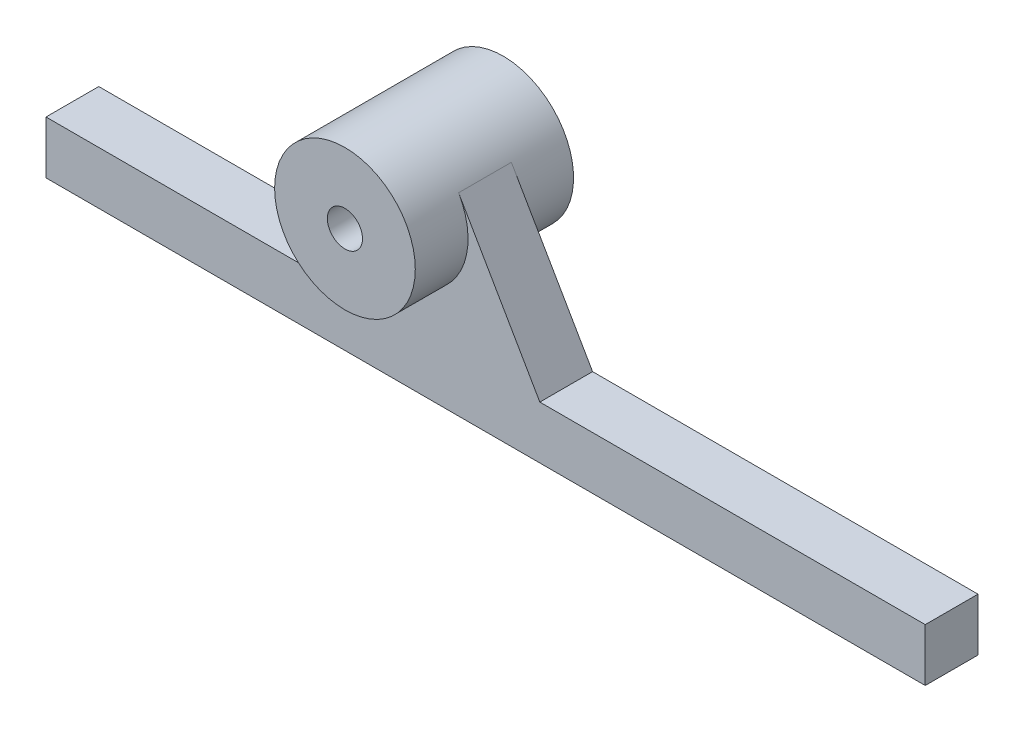
from build123d import *

# Parameters (mm, degrees)
SKETCH_1_R      = 5
EXTRUDE_1_DEPTH = 15
SKETCH_2_R      = 20
SKETCH_2_R_2    = 5
EXTRUDE_2_DEPTH = 15
EXTRUDE_START   = 15
SKETCH_3_R      = 20
SKETCH_3_R_2    = 5
EXTRUDE_3_DEPTH = 15


with BuildPart() as part:
    # 草图1 → 凸台-拉伸1 (new body)
    with BuildSketch(Plane.XY):
        with BuildLine():
            Line((-100, 0), (150, 0))
            Line((150, 0), (150, 15))
            Line((150, 15), (40.414518843, 15))
            Line((40.414518843, 15), (17.320508076, 55))
            ThreePointArc((17.320508076, 55), (-3.472963553, 64.69615506), (-19.69615506, 48.472963553))
            Line((-19.69615506, 48.472963553), (-25.598341659, 15))
            Line((-25.598341659, 15), (-100, 15))
            Line((-100, 15), (-100, 0))
        make_face()
        with Locations((0, 45)):
            Circle(SKETCH_1_R, mode=Mode.SUBTRACT)
    extrude(amount=EXTRUDE_1_DEPTH)

    # 草图2 → 凸台-拉伸2 (add)
    with BuildSketch(Plane.XY.offset(15)):
        with Locations(Location((0, 45, 0), (0, 0, 170))):
            Circle(SKETCH_2_R)
        with Locations((0, 45)):
            Circle(SKETCH_2_R_2, mode=Mode.SUBTRACT)
    extrude(amount=EXTRUDE_2_DEPTH)

    # 草图3 → 凸台-拉伸3 (add)
    with BuildSketch(Plane(origin=(0, 0, 0), x_dir=(-1, 0, 0), z_dir=(0, 0, -1)).offset(EXTRUDE_START)):
        with Locations((0, 45)):
            Circle(SKETCH_3_R)
        with Locations((0, 45)):
            Circle(SKETCH_3_R_2, mode=Mode.SUBTRACT)
    extrude(amount=-EXTRUDE_3_DEPTH)


solid = part.part
